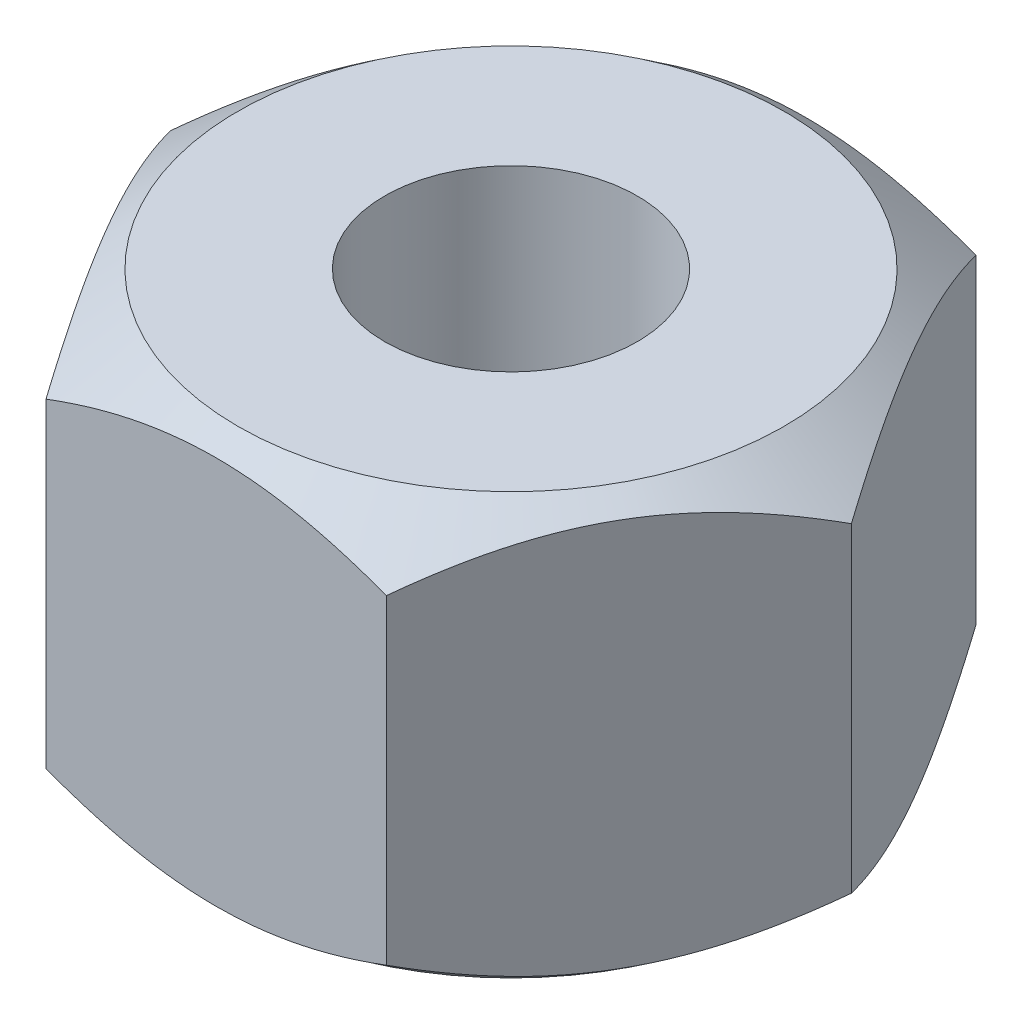
from build123d import *

# Parameters (mm, degrees)
BOSS_EXTRUDE1_DEPTH = 2.5
SKETCH4_R           = 1.5
CUT_EXTRUDE1_DEPTH  = 5
SKETCH5_R           = 1.35
BOSS_EXTRUDE2_DEPTH = 0.6
SKETCH6_R           = 0.85
CUT_EXTRUDE3_DEPTH  = 1


with BuildPart() as part:
    # Sketch1 → Boss-Extrude1 (new, symmetric)
    with BuildSketch(Plane(origin=(0, 0, 0), x_dir=(1, 0, 0), z_dir=(0, 1, 0))):
        Polygon((4.041451884, 0), (2.020725942, 3.5), (-2.020725942, 3.5), (-4.041451884, 0), (-2.020725942, -3.5), (2.020725942, -3.5), align=None)
    extrude(amount=BOSS_EXTRUDE1_DEPTH, both=True)

    # Sketch2 → Cut-Revolve1 (revolve, cut)
    with BuildSketch(Plane.XY, mode=Mode.PRIVATE) as cut_revolve1_sk:
        Polygon((4.041451884, 2.5), (3.241451884, 2.5), (4.041451884, 1.9), align=None)
        Polygon((4.041451884, -2.5), (4.041451884, -1.9), (3.241451884, -2.5), align=None)
    revolve(cut_revolve1_sk.sketch.rotate(Axis((0, 2.5, 0), (0, -1, 0)), 90), axis=Axis((0, 2.5, 0), (0, -1, 0)), mode=Mode.SUBTRACT)

    # Sketch4 → Cut-Extrude1 (cut)
    with BuildSketch(Plane(origin=(0, 2.5, 0), x_dir=(1, 0, 0), z_dir=(0, 1, 0))):
        with Locations(Location((0, 0, 0), (0, 0, 270))):
            Circle(SKETCH4_R)
    extrude(amount=-CUT_EXTRUDE1_DEPTH, mode=Mode.SUBTRACT)

    # Sketch5 → Boss-Extrude2 (add)
    with BuildSketch(Plane(origin=(-3.031088913, 0, -1.75), x_dir=(-0.4999999999999951, 0, 0.8660254037844415), z_dir=(-0.8660254037844416, 0, -0.49999999999999517))):
        with Locations(Location((0, 0, 0), (0, 0, 180))):
            Circle(SKETCH5_R)
    extrude(amount=BOSS_EXTRUDE2_DEPTH)

    # Sketch6 → Cut-Extrude3 (cut)
    with BuildSketch(Plane(origin=(-3.550704156, 0, -2.05), x_dir=(-0.4999999999999952, 0, 0.8660254037844414), z_dir=(-0.8660254037844414, 0, -0.4999999999999952))):
        Circle(SKETCH6_R)
    extrude(amount=-CUT_EXTRUDE3_DEPTH, mode=Mode.SUBTRACT)


solid = part.part
